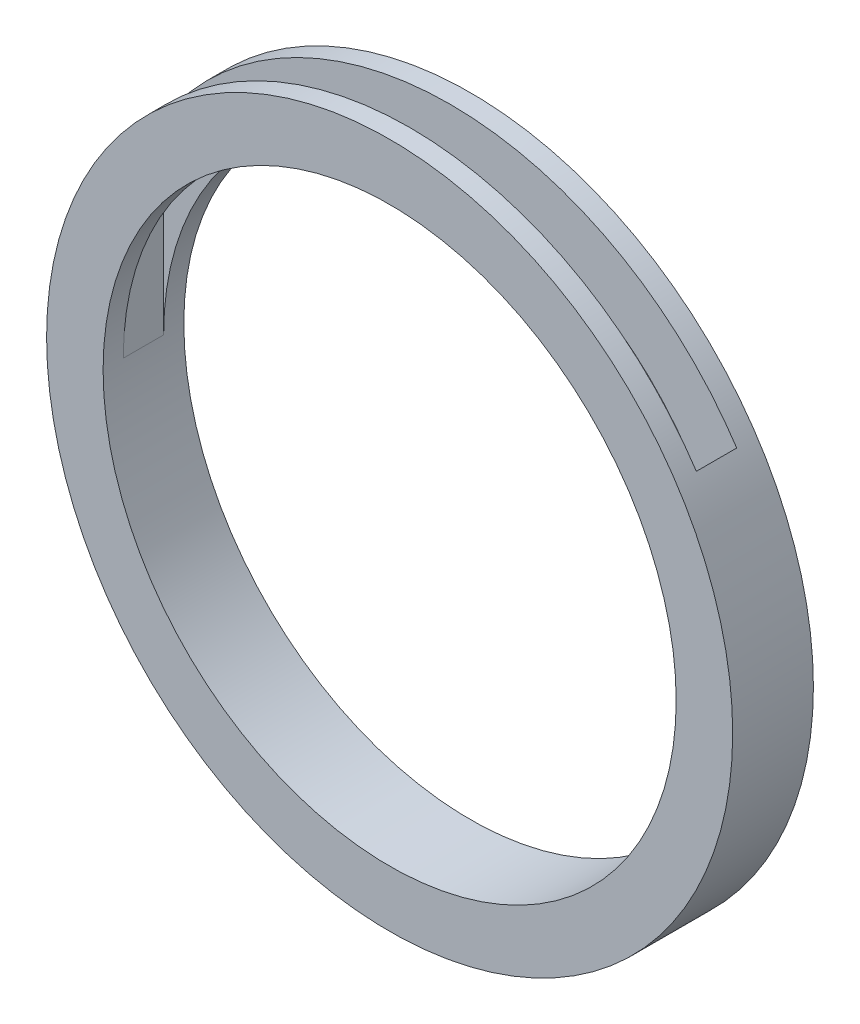
from build123d import *
from build123d.topology import SkipClean

# Parameters (mm, degrees)
SKETCH1_R                = 21.59
BOSS_EXTRUDE1_DEPTH      = 5.08
SKETCH4_R                = 18.034
CUT_EXTRUDE1_DEPTH       = 31.952586322
SKETCH5_W                = 43.18
SKETCH5_H                = 2.54
CUT_EXTRUDE2_DEPTH       = 31.952586322
BOSS_EXTRUDE2_REACH      = 32.953
BOSS_EXTRUDE2_END_RADIUS = 21.59
SKETCH6_W                = 3.556
SKETCH6_H                = 2.54


with BuildPart() as part:
    # Sketch1 → Boss-Extrude1 (new body)
    with BuildSketch(Plane.XY):
        Circle(SKETCH1_R)
    extrude(amount=BOSS_EXTRUDE1_DEPTH)

    # Sketch4 → Cut-Extrude1 (cut, through all)
    with BuildSketch(Plane.XY.offset(5.08)):
        Circle(SKETCH4_R)
    extrude(amount=-CUT_EXTRUDE1_DEPTH, mode=Mode.SUBTRACT)

    # Sketch5 → Cut-Extrude2 (cut, through all)
    with BuildSketch(Plane(origin=(0, 0, 0), x_dir=(1, 0, 0), z_dir=(0, 1, 0))):
        with Locations((0, -2.54)):
            Rectangle(SKETCH5_W, SKETCH5_H)
    extrude(amount=CUT_EXTRUDE2_DEPTH, mode=Mode.SUBTRACT)

    # Boss-Extrude2: up to this cylinder (the profile starts inside it)
    with SkipClean():  # the faces are left unmerged after this step: merging them gives an invalid solid
        boss_extrude2_end = Plane(origin=(0, 0, 2.54), z_dir=(0, 0, -1)) * Cylinder(BOSS_EXTRUDE2_END_RADIUS, 110.086, mode=Mode.PRIVATE)
        # Sketch6 → Boss-Extrude2 (add, up to the surface)
        with BuildSketch(Plane(origin=(0, 0, 0), x_dir=(1, 0, 0), z_dir=(0, 1, 0)), mode=Mode.PRIVATE) as boss_extrude2_sk1:
            with Locations((-19.812, -2.54)):
                Rectangle(SKETCH6_W, SKETCH6_H)
        boss_extrude2_tool1 = extrude(boss_extrude2_sk1.sketch, amount=BOSS_EXTRUDE2_REACH, mode=Mode.PRIVATE) & boss_extrude2_end
        add(boss_extrude2_tool1.solids().sort_by_distance((-19.812, 0, 2.54))[0])
        # Sketch6 → Boss-Extrude2 (add, up to the surface)
        with BuildSketch(Plane(origin=(0, 0, 0), x_dir=(1, 0, 0), z_dir=(0, 1, 0)), mode=Mode.PRIVATE) as boss_extrude2_sk2:
            with Locations((19.812, -2.54)):
                Rectangle(SKETCH6_W, SKETCH6_H)
        boss_extrude2_tool2 = extrude(boss_extrude2_sk2.sketch, amount=BOSS_EXTRUDE2_REACH, mode=Mode.PRIVATE) & boss_extrude2_end
        add(boss_extrude2_tool2.solids().sort_by_distance((19.812, 0, 2.54))[0])


solid = part.part
